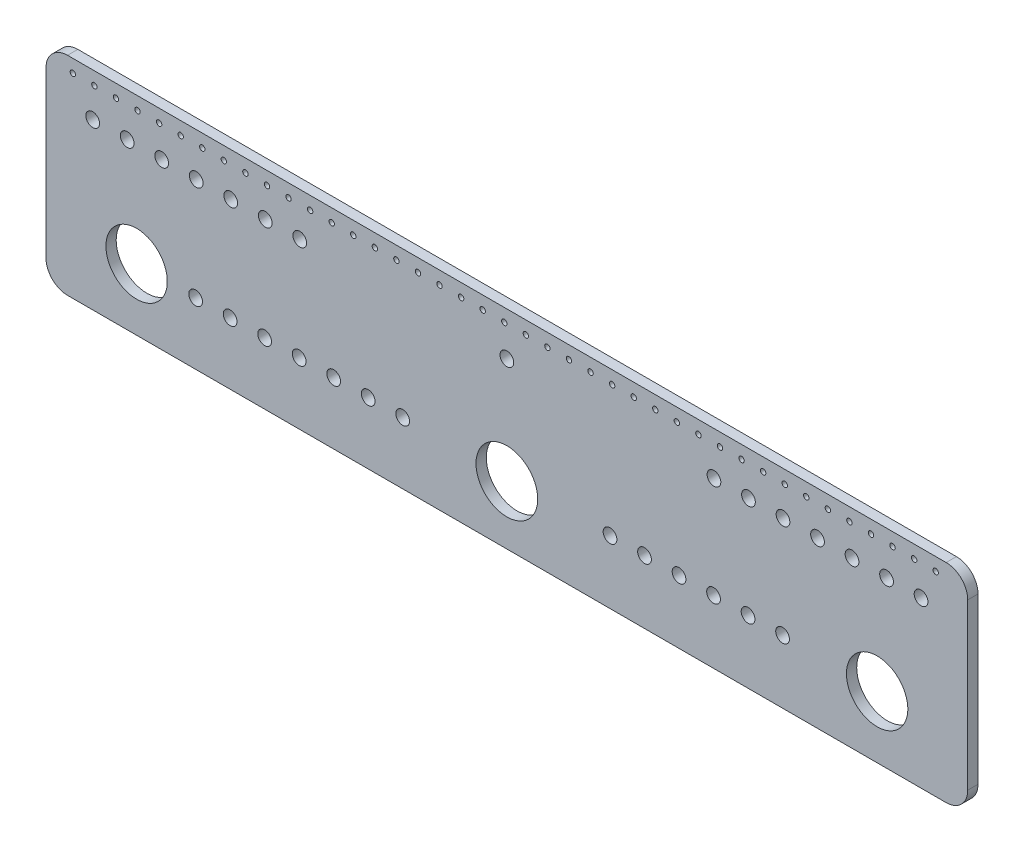
from build123d import *

# Parameters (mm, degrees)
SKETCH1_R           = 14.225
SKETCH1_R_2         = 14.3
SKETCH1_R_3         = 3.18
SKETCH1_R_4         = 1.25
BOSS_EXTRUDE5_DEPTH = 4.7625


with BuildPart() as part:
    # Sketch1 → Boss-Extrude5 (new body)
    with BuildSketch(Plane.XY):
        with BuildLine():
            Line((-426.349770336, 80.490429708), (-19.069770336, 80.490429708))
            ThreePointArc((-19.069770336, 80.490429708), (-11.998702525, 77.56149752), (-9.069770336, 70.490429708))
            Line((-9.069770336, 70.490429708), (-9.069770336, -5.909570292))
            ThreePointArc((-9.069770336, -5.909570292), (-11.998702525, -12.980638104), (-19.069770336, -15.909570292))
            Line((-19.069770336, -15.909570292), (-426.349770336, -15.909570292))
            ThreePointArc((-426.349770336, -15.909570292), (-433.420838148, -12.980638104), (-436.349770336, -5.909570292))
            Line((-436.349770336, -5.909570292), (-436.349770336, 70.490429708))
            ThreePointArc((-436.349770336, 70.490429708), (-433.420838148, 77.56149752), (-426.349770336, 80.490429708))
        make_face()
        with Locations(Location((-394.349770336, 12.790429708, 0), (0, 0, 180))):
            Circle(SKETCH1_R, mode=Mode.SUBTRACT)
        with Locations(Location((-51.069770336, 12.790429708, 0), (0, 0, 180))):
            Circle(SKETCH1_R, mode=Mode.SUBTRACT)
        with Locations(Location((-222.709770336, 11.290429708, 0), (0, 0, 180))):
            Circle(SKETCH1_R_2, mode=Mode.SUBTRACT)
        with Locations(Location((-174.899770336, 13.384511017, 0), (0, 0, 180))):
            Circle(SKETCH1_R_3, mode=Mode.SUBTRACT)
        with Locations(Location((-366.990768764, 12.790429708, 0), (0, 0, 180))):
            Circle(SKETCH1_R_3, mode=Mode.SUBTRACT)
        with Locations(Location((-94.899770336, 13.384511017, 0), (0, 0, 180))):
            Circle(SKETCH1_R_3, mode=Mode.SUBTRACT)
        with Locations(Location((-350.990768764, 12.790429708, 0), (0, 0, 180))):
            Circle(SKETCH1_R_3, mode=Mode.SUBTRACT)
        with Locations(Location((-334.990768764, 12.790429708, 0), (0, 0, 180))):
            Circle(SKETCH1_R_3, mode=Mode.SUBTRACT)
        with Locations(Location((-318.990768764, 12.790429708, 0), (0, 0, 180))):
            Circle(SKETCH1_R_3, mode=Mode.SUBTRACT)
        with Locations(Location((-302.990768764, 12.790429708, 0), (0, 0, 180))):
            Circle(SKETCH1_R_3, mode=Mode.SUBTRACT)
        with Locations(Location((-286.990768764, 12.790429708, 0), (0, 0, 180))):
            Circle(SKETCH1_R_3, mode=Mode.SUBTRACT)
        with Locations(Location((-158.899770336, 13.384511017, 0), (0, 0, 180))):
            Circle(SKETCH1_R_3, mode=Mode.SUBTRACT)
        with Locations(Location((-142.899770336, 13.384511017, 0), (0, 0, 180))):
            Circle(SKETCH1_R_3, mode=Mode.SUBTRACT)
        with Locations(Location((-126.899770336, 13.384511017, 0), (0, 0, 180))):
            Circle(SKETCH1_R_3, mode=Mode.SUBTRACT)
        with Locations(Location((-110.899770336, 13.384511017, 0), (0, 0, 180))):
            Circle(SKETCH1_R_3, mode=Mode.SUBTRACT)
        with Locations(Location((-270.990768764, 12.790429708, 0), (0, 0, 180))):
            Circle(SKETCH1_R_3, mode=Mode.SUBTRACT)
        with Locations(Location((-213.909770336, 74.490429708, 0), (0, 0, 180))):
            Circle(SKETCH1_R_4, mode=Mode.SUBTRACT)
        with Locations(Location((-30.709770336, 60.490429708, 0), (0, 0, 180))):
            Circle(SKETCH1_R_3, mode=Mode.SUBTRACT)
        with Locations(Location((-414.709770336, 60.490429708, 0), (0, 0, 180))):
            Circle(SKETCH1_R_3, mode=Mode.SUBTRACT)
        with Locations(Location((-203.909770336, 74.490429708, 0), (0, 0, 180))):
            Circle(SKETCH1_R_4, mode=Mode.SUBTRACT)
        with Locations(Location((-193.909770336, 74.490429708, 0), (0, 0, 180))):
            Circle(SKETCH1_R_4, mode=Mode.SUBTRACT)
        with Locations(Location((-183.909770336, 74.490429708, 0), (0, 0, 180))):
            Circle(SKETCH1_R_4, mode=Mode.SUBTRACT)
        with Locations(Location((-173.909770336, 74.490429708, 0), (0, 0, 180))):
            Circle(SKETCH1_R_4, mode=Mode.SUBTRACT)
        with Locations(Location((-163.909770336, 74.490429708, 0), (0, 0, 180))):
            Circle(SKETCH1_R_4, mode=Mode.SUBTRACT)
        with Locations(Location((-153.909770336, 74.490429708, 0), (0, 0, 180))):
            Circle(SKETCH1_R_4, mode=Mode.SUBTRACT)
        with Locations(Location((-143.909770336, 74.490429708, 0), (0, 0, 180))):
            Circle(SKETCH1_R_4, mode=Mode.SUBTRACT)
        with Locations(Location((-133.909770336, 74.490429708, 0), (0, 0, 180))):
            Circle(SKETCH1_R_4, mode=Mode.SUBTRACT)
        with Locations(Location((-123.909770336, 74.490429708, 0), (0, 0, 180))):
            Circle(SKETCH1_R_4, mode=Mode.SUBTRACT)
        with Locations(Location((-113.909770336, 74.490429708, 0), (0, 0, 180))):
            Circle(SKETCH1_R_4, mode=Mode.SUBTRACT)
        with Locations(Location((-103.909770336, 74.490429708, 0), (0, 0, 180))):
            Circle(SKETCH1_R_4, mode=Mode.SUBTRACT)
        with Locations(Location((-93.909770336, 74.490429708, 0), (0, 0, 180))):
            Circle(SKETCH1_R_4, mode=Mode.SUBTRACT)
        with Locations(Location((-83.909770336, 74.490429708, 0), (0, 0, 180))):
            Circle(SKETCH1_R_4, mode=Mode.SUBTRACT)
        with Locations(Location((-73.909770336, 74.490429708, 0), (0, 0, 180))):
            Circle(SKETCH1_R_4, mode=Mode.SUBTRACT)
        with Locations(Location((-63.909770336, 74.490429708, 0), (0, 0, 180))):
            Circle(SKETCH1_R_4, mode=Mode.SUBTRACT)
        with Locations(Location((-53.909770336, 74.490429708, 0), (0, 0, 180))):
            Circle(SKETCH1_R_4, mode=Mode.SUBTRACT)
        with Locations(Location((-43.909770336, 74.490429708, 0), (0, 0, 180))):
            Circle(SKETCH1_R_4, mode=Mode.SUBTRACT)
        with Locations(Location((-33.909770336, 74.490429708, 0), (0, 0, 180))):
            Circle(SKETCH1_R_4, mode=Mode.SUBTRACT)
        with Locations(Location((-23.909770336, 74.490429708, 0), (0, 0, 180))):
            Circle(SKETCH1_R_4, mode=Mode.SUBTRACT)
        with Locations(Location((-223.909770336, 74.490429708, 0), (0, 0, 180))):
            Circle(SKETCH1_R_4, mode=Mode.SUBTRACT)
        with Locations(Location((-233.909770336, 74.490429708, 0), (0, 0, 180))):
            Circle(SKETCH1_R_4, mode=Mode.SUBTRACT)
        with Locations(Location((-243.909770336, 74.490429708, 0), (0, 0, 180))):
            Circle(SKETCH1_R_4, mode=Mode.SUBTRACT)
        with Locations(Location((-253.909770336, 74.490429708, 0), (0, 0, 180))):
            Circle(SKETCH1_R_4, mode=Mode.SUBTRACT)
        with Locations(Location((-263.909770336, 74.490429708, 0), (0, 0, 180))):
            Circle(SKETCH1_R_4, mode=Mode.SUBTRACT)
        with Locations(Location((-273.909770336, 74.490429708, 0), (0, 0, 180))):
            Circle(SKETCH1_R_4, mode=Mode.SUBTRACT)
        with Locations(Location((-283.909770336, 74.490429708, 0), (0, 0, 180))):
            Circle(SKETCH1_R_4, mode=Mode.SUBTRACT)
        with Locations(Location((-293.909770336, 74.490429708, 0), (0, 0, 180))):
            Circle(SKETCH1_R_4, mode=Mode.SUBTRACT)
        with Locations(Location((-303.909770336, 74.490429708, 0), (0, 0, 180))):
            Circle(SKETCH1_R_4, mode=Mode.SUBTRACT)
        with Locations(Location((-313.909770336, 74.490429708, 0), (0, 0, 180))):
            Circle(SKETCH1_R_4, mode=Mode.SUBTRACT)
        with Locations(Location((-323.909770336, 74.490429708, 0), (0, 0, 180))):
            Circle(SKETCH1_R_4, mode=Mode.SUBTRACT)
        with Locations(Location((-333.909770336, 74.490429708, 0), (0, 0, 180))):
            Circle(SKETCH1_R_4, mode=Mode.SUBTRACT)
        with Locations(Location((-343.909770336, 74.490429708, 0), (0, 0, 180))):
            Circle(SKETCH1_R_4, mode=Mode.SUBTRACT)
        with Locations(Location((-353.909770336, 74.490429708, 0), (0, 0, 180))):
            Circle(SKETCH1_R_4, mode=Mode.SUBTRACT)
        with Locations(Location((-363.909770336, 74.490429708, 0), (0, 0, 180))):
            Circle(SKETCH1_R_4, mode=Mode.SUBTRACT)
        with Locations(Location((-373.909770336, 74.490429708, 0), (0, 0, 180))):
            Circle(SKETCH1_R_4, mode=Mode.SUBTRACT)
        with Locations(Location((-383.909770336, 74.490429708, 0), (0, 0, 180))):
            Circle(SKETCH1_R_4, mode=Mode.SUBTRACT)
        with Locations(Location((-393.909770336, 74.490429708, 0), (0, 0, 180))):
            Circle(SKETCH1_R_4, mode=Mode.SUBTRACT)
        with Locations(Location((-403.909770336, 74.490429708, 0), (0, 0, 180))):
            Circle(SKETCH1_R_4, mode=Mode.SUBTRACT)
        with Locations(Location((-413.909770336, 74.490429708, 0), (0, 0, 180))):
            Circle(SKETCH1_R_4, mode=Mode.SUBTRACT)
        with Locations(Location((-423.909770336, 74.490429708, 0), (0, 0, 180))):
            Circle(SKETCH1_R_4, mode=Mode.SUBTRACT)
        with Locations(Location((-222.709770336, 60.490429708, 0), (0, 0, 180))):
            Circle(SKETCH1_R_3, mode=Mode.SUBTRACT)
        with Locations(Location((-398.709770336, 60.490429708, 0), (0, 0, 180))):
            Circle(SKETCH1_R_3, mode=Mode.SUBTRACT)
        with Locations(Location((-382.709770336, 60.490429708, 0), (0, 0, 180))):
            Circle(SKETCH1_R_3, mode=Mode.SUBTRACT)
        with Locations(Location((-366.709770336, 60.490429708, 0), (0, 0, 180))):
            Circle(SKETCH1_R_3, mode=Mode.SUBTRACT)
        with Locations(Location((-350.709770336, 60.490429708, 0), (0, 0, 180))):
            Circle(SKETCH1_R_3, mode=Mode.SUBTRACT)
        with Locations(Location((-334.709770336, 60.490429708, 0), (0, 0, 180))):
            Circle(SKETCH1_R_3, mode=Mode.SUBTRACT)
        with Locations(Location((-318.709770336, 60.490429708, 0), (0, 0, 180))):
            Circle(SKETCH1_R_3, mode=Mode.SUBTRACT)
        with Locations(Location((-46.709770336, 60.490429708, 0), (0, 0, 180))):
            Circle(SKETCH1_R_3, mode=Mode.SUBTRACT)
        with Locations(Location((-62.709770336, 60.490429708, 0), (0, 0, 180))):
            Circle(SKETCH1_R_3, mode=Mode.SUBTRACT)
        with Locations(Location((-78.709770336, 60.490429708, 0), (0, 0, 180))):
            Circle(SKETCH1_R_3, mode=Mode.SUBTRACT)
        with Locations(Location((-94.709770336, 60.490429708, 0), (0, 0, 180))):
            Circle(SKETCH1_R_3, mode=Mode.SUBTRACT)
        with Locations(Location((-110.709770336, 60.490429708, 0), (0, 0, 180))):
            Circle(SKETCH1_R_3, mode=Mode.SUBTRACT)
        with Locations(Location((-126.709770336, 60.490429708, 0), (0, 0, 180))):
            Circle(SKETCH1_R_3, mode=Mode.SUBTRACT)
    extrude(amount=BOSS_EXTRUDE5_DEPTH)


solid = part.part
